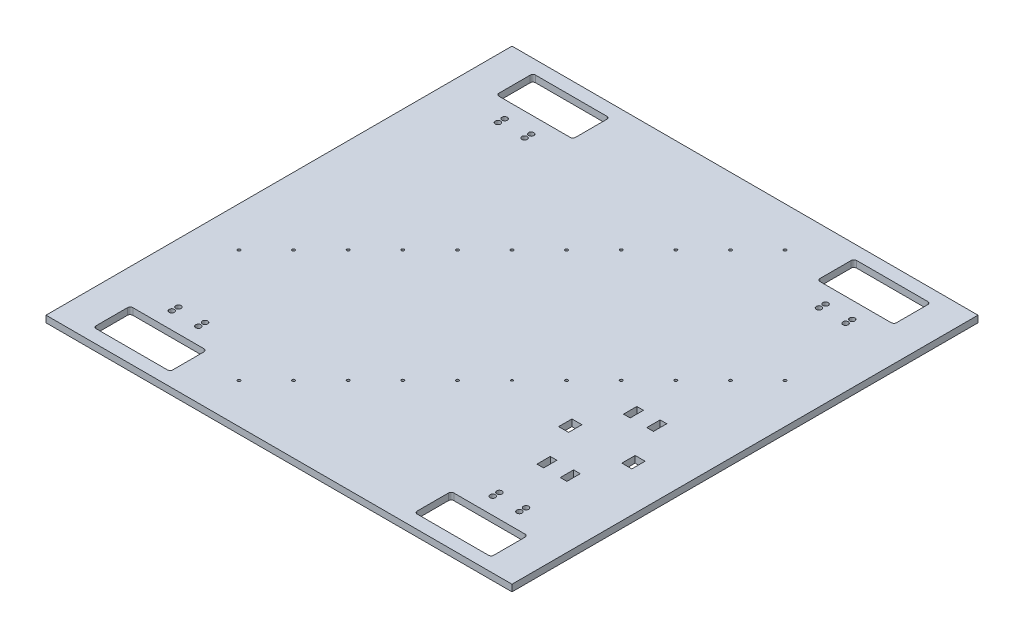
from build123d import *

# Parameters (mm, degrees)
SKETCH1_W                                  = 700
SKETCH1_H                                  = 700
BOSS_EXTRUDE1_DEPTH                        = 10
SKETCH2_R                                  = 4
SKETCH2_W                                  = 115
SKETCH2_H                                  = 55
CUT_EXTRUDE2_DEPTH                         = 10
FILLET1_R                                  = 4
MIRROR3_AT_THE_SECOND_PLANE_COPY_1_SKETC_R = 4
MIRROR3_AT_THE_SECOND_PLANE_COPY_1_SKETC_W = 115
MIRROR3_AT_THE_SECOND_PLANE_COPY_1_SKETC_H = 55
MIRROR3_AT_THE_SECOND_PLANE_COPY_1_DEPTH   = 10
FILLET2_R                                  = 4
SKETCH3_R                                  = 2.1
SKETCH3_R_2                                = 1.6
CUT_EXTRUDE3_DEPTH                         = 991
SKETCH4_W                                  = 10
SKETCH4_H                                  = 20
SKETCH4_W_2                                = 15
CUT_EXTRUDE4_DEPTH                         = 991


with BuildPart() as part:
    # Sketch1 → Boss-Extrude1 (new body)
    with BuildSketch(Plane(origin=(0, 0, 0), x_dir=(1, 0, 0), z_dir=(0, 1, 0))):
        with Locations((350, 350)):
            Rectangle(SKETCH1_W, SKETCH1_H)
    extrude(amount=BOSS_EXTRUDE1_DEPTH)

    # Sketch2 → Cut-Extrude2 (cut)
    with BuildSketch(Plane(origin=(0, 10, 0), x_dir=(1, 0, 0), z_dir=(0, 1, 0))):
        with Locations(Location((88.9, 110, 0), (0, 0, 270))):
            Circle(SKETCH2_R)
        with Locations(Location((128.9, 110, 0), (0, 0, 270))):
            Circle(SKETCH2_R)
        with Locations(Location((128.9, 100, 0), (0, 0, 270))):
            Circle(SKETCH2_R)
        with Locations(Location((88.9, 100, 0), (0, 0, 270))):
            Circle(SKETCH2_R)
        with Locations((108.9, 47.5)):
            Rectangle(SKETCH2_W, SKETCH2_H)
    cut_extrude2 = extrude(amount=-CUT_EXTRUDE2_DEPTH, mode=Mode.SUBTRACT)

    # Fillet1
    fillet1_edges = [part.edges().sort_by_distance(p)[0] for p in [
        (51.4, 5, -75),
        (166.4, 5, -75),
        (166.4, 5, -20),
        (51.4, 5, -20),
    ]]
    fillet(fillet1_edges, radius=FILLET1_R)

    # Mirror3: Cut-Extrude2 across plane
    add(cut_extrude2.mirror(Plane.XY.offset(-350)), mode=Mode.SUBTRACT)

    # Mirror3 at the second plane: Cut-Extrude2 across plane
    add(cut_extrude2.mirror(Plane.ZY.offset(-350)), mode=Mode.SUBTRACT)

    # Mirror3 at the second plane copy 1 sketc → Mirror3 at the second plane copy 1 (cut)
    with BuildSketch(Plane(origin=(700, 10, -700), x_dir=(-1, 0, 0), z_dir=(0, 1, 0))):
        with Locations(Location((88.9, 110, 0), (0, 0, 270))):
            Circle(MIRROR3_AT_THE_SECOND_PLANE_COPY_1_SKETC_R)
        with Locations(Location((128.9, 110, 0), (0, 0, 270))):
            Circle(MIRROR3_AT_THE_SECOND_PLANE_COPY_1_SKETC_R)
        with Locations(Location((128.9, 100, 0), (0, 0, 270))):
            Circle(MIRROR3_AT_THE_SECOND_PLANE_COPY_1_SKETC_R)
        with Locations(Location((88.9, 100, 0), (0, 0, 270))):
            Circle(MIRROR3_AT_THE_SECOND_PLANE_COPY_1_SKETC_R)
        with Locations((108.9, 47.5)):
            Rectangle(MIRROR3_AT_THE_SECOND_PLANE_COPY_1_SKETC_W, MIRROR3_AT_THE_SECOND_PLANE_COPY_1_SKETC_H)
    extrude(amount=-MIRROR3_AT_THE_SECOND_PLANE_COPY_1_DEPTH, mode=Mode.SUBTRACT)

    # Fillet2
    fillet2_edges = [part.edges().sort_by_distance(p)[0] for p in [
        (166.4, 5, -625),
        (51.4, 5, -625),
        (51.4, 5, -680),
        (166.4, 5, -680),
        (648.6, 5, -625),
        (533.6, 5, -625),
        (533.6, 5, -680),
        (648.6, 5, -680),
        (533.6, 5, -75),
        (648.6, 5, -75),
        (648.6, 5, -20),
        (533.6, 5, -20),
    ]]
    fillet(fillet2_edges, radius=FILLET2_R)

    # Sketch3 → Cut-Extrude3 (cut, through all)
    with BuildSketch(Plane(origin=(0, 10, 0), x_dir=(1, 0, 0), z_dir=(0, 1, 0))):
        with Locations(Location((470.208152802, 639.913780286, 0), (0, 0, 270))):
            Circle(SKETCH3_R)
        with Locations(Location((60.086219714, 229.791847198, 0), (0, 0, 90))):
            Circle(SKETCH3_R)
        with Locations(Location((639.913780286, 470.208152802, 0), (0, 0, 90))):
            Circle(SKETCH3_R)
        with Locations(Location((429.195959493, 598.901586978, 0), (0, 0, 270))):
            Circle(SKETCH3_R)
        with Locations(Location((388.183766184, 557.889393669, 0), (0, 0, 270))):
            Circle(SKETCH3_R)
        with Locations(Location((347.171572875, 516.87720036, 0), (0, 0, 270))):
            Circle(SKETCH3_R)
        with Locations(Location((306.159379566, 475.865007051, 0), (0, 0, 270))):
            Circle(SKETCH3_R)
        with Locations(Location((265.147186258, 434.852813742, 0), (0, 0, 270))):
            Circle(SKETCH3_R)
        with Locations(Location((224.134992949, 393.840620434, 0), (0, 0, 270))):
            Circle(SKETCH3_R)
        with Locations(Location((183.12279964, 352.828427125, 0), (0, 0, 270))):
            Circle(SKETCH3_R)
        with Locations(Location((142.110606331, 311.816233816, 0), (0, 0, 270))):
            Circle(SKETCH3_R)
        with Locations(Location((101.098413022, 270.804040507, 0), (0, 0, 270))):
            Circle(SKETCH3_R)
        with Locations(Location((229.791847198, 60.086219714, 0), (0, 0, 270))):
            Circle(SKETCH3_R)
        with Locations(Location((270.804040507, 101.098413022, 0), (0, 0, 90))):
            Circle(SKETCH3_R)
        with Locations(Location((311.816233816, 142.110606331, 0), (0, 0, 90))):
            Circle(SKETCH3_R)
        with Locations(Location((352.828427125, 183.12279964, 0), (0, 0, 90))):
            Circle(SKETCH3_R)
        with Locations(Location((393.840620434, 224.134992949, 0), (0, 0, 90))):
            Circle(SKETCH3_R)
        with Locations(Location((434.852813742, 265.147186258, 0), (0, 0, 90))):
            Circle(SKETCH3_R_2)
        with Locations(Location((475.865007051, 306.159379566, 0), (0, 0, 90))):
            Circle(SKETCH3_R)
        with Locations(Location((516.87720036, 347.171572875, 0), (0, 0, 90))):
            Circle(SKETCH3_R)
        with Locations(Location((557.889393669, 388.183766184, 0), (0, 0, 90))):
            Circle(SKETCH3_R)
        with Locations(Location((598.901586978, 429.195959493, 0), (0, 0, 90))):
            Circle(SKETCH3_R)
    extrude(amount=-CUT_EXTRUDE3_DEPTH, mode=Mode.SUBTRACT)

    # Sketch4 → Cut-Extrude4 (cut, through all)
    with BuildSketch(Plane(origin=(0, 10, 0), x_dir=(1, 0, 0), z_dir=(0, 1, 0))):
        with Locations((602.5, 315)):
            Rectangle(SKETCH4_W, SKETCH4_H)
        with Locations((602.5, 185)):
            Rectangle(SKETCH4_W, SKETCH4_H)
        with Locations((567.5, 315)):
            Rectangle(SKETCH4_W, SKETCH4_H)
        with Locations((567.5, 185)):
            Rectangle(SKETCH4_W, SKETCH4_H)
        with Locations((537.5, 250)):
            Rectangle(SKETCH4_W_2, SKETCH4_H)
        with Locations((632.5, 250)):
            Rectangle(SKETCH4_W_2, SKETCH4_H)
    extrude(amount=-CUT_EXTRUDE4_DEPTH, mode=Mode.SUBTRACT)


solid = part.part
